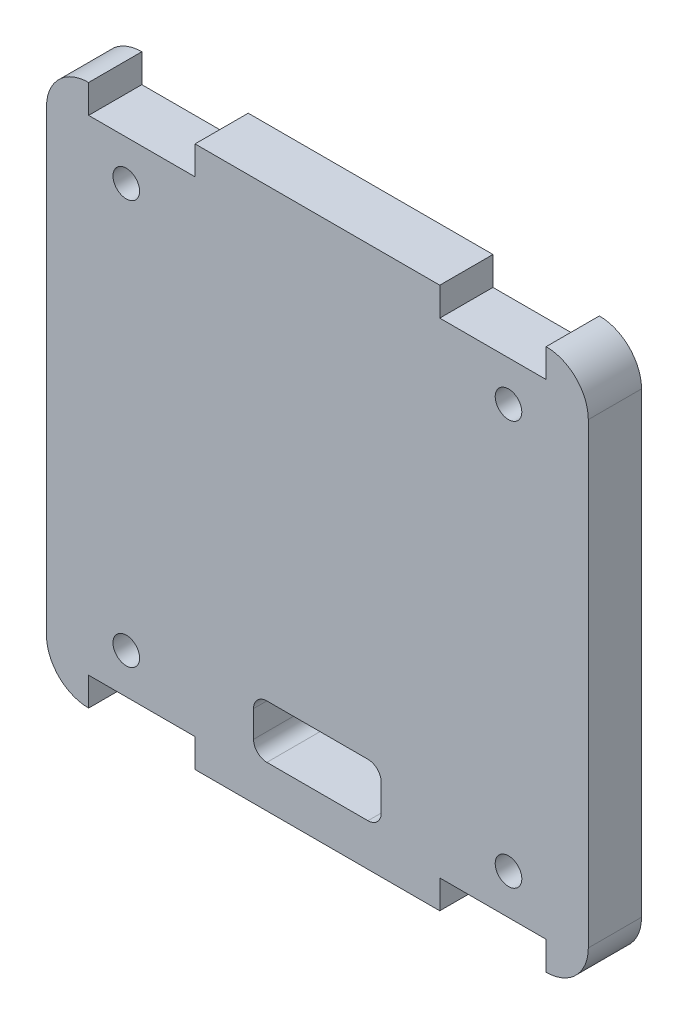
from build123d import *

# Parameters (mm, degrees)
SKETCH1_R           = 1.5875
BOSS_EXTRUDE1_DEPTH = 6.35


with BuildPart() as part:
    # Sketch1 → Boss-Extrude1 (new body)
    with BuildSketch(Plane.XY):
        with BuildLine():
            Line((8672.435520807, 2967.694852803), (8672.435520807, 2913.084852803))
            ThreePointArc((8672.435520807, 2913.084852803), (8670.962502231, 2909.528671379), (8667.406320807, 2908.055652803))
            Line((8667.406320807, 2908.055652803), (8667.406320807, 2911.459252803))
            Line((8667.406320807, 2911.459252803), (8654.706320807, 2911.459252803))
            Line((8654.706320807, 2911.459252803), (8654.706320807, 2908.055652803))
            Line((8654.706320807, 2908.055652803), (8625.496320807, 2908.055652803))
            Line((8625.496320807, 2908.055652803), (8625.496320807, 2911.459252803))
            Line((8625.496320807, 2911.459252803), (8612.796320807, 2911.459252803))
            Line((8612.796320807, 2911.459252803), (8612.796320807, 2908.055652803))
            ThreePointArc((8612.796320807, 2908.055652803), (8609.240139383, 2909.528671379), (8607.767120807, 2913.084852803))
            Line((8607.767120807, 2913.084852803), (8607.767120807, 2967.694852803))
            ThreePointArc((8607.767120807, 2967.694852803), (8609.240139383, 2971.251034227), (8612.796320807, 2972.724052803))
            Line((8612.796320807, 2972.724052803), (8612.796320807, 2969.320452803))
            Line((8612.796320807, 2969.320452803), (8625.496320807, 2969.320452803))
            Line((8625.496320807, 2969.320452803), (8625.496320807, 2972.724052803))
            Line((8625.496320807, 2972.724052803), (8654.706320807, 2972.724052803))
            Line((8654.706320807, 2972.724052803), (8654.706320807, 2969.320452803))
            Line((8654.706320807, 2969.320452803), (8667.406320807, 2969.320452803))
            Line((8667.406320807, 2969.320452803), (8667.406320807, 2972.724052803))
            ThreePointArc((8667.406320807, 2972.724052803), (8670.962502231, 2971.251034227), (8672.435520807, 2967.694852803))
        make_face()
        with Locations((8662.910520807, 2964.519852803)):
            Circle(SKETCH1_R, mode=Mode.SUBTRACT)
        with Locations((8662.910520807, 2916.259852803)):
            Circle(SKETCH1_R, mode=Mode.SUBTRACT)
        with Locations((8617.292120807, 2964.519852803)):
            Circle(SKETCH1_R, mode=Mode.SUBTRACT)
        with Locations((8617.292120807, 2916.259852803)):
            Circle(SKETCH1_R, mode=Mode.SUBTRACT)
        with BuildLine():
            Line((8634.068820807, 2913.084852803), (8646.133820807, 2913.084852803))
            ThreePointArc((8646.133820807, 2913.084852803), (8647.256352822, 2913.549820788), (8647.721320807, 2914.672352803))
            Line((8647.721320807, 2914.672352803), (8647.721320807, 2917.847352803))
            ThreePointArc((8647.721320807, 2917.847352803), (8647.256352822, 2918.969884819), (8646.133820807, 2919.434852803))
            Line((8646.133820807, 2919.434852803), (8634.068820807, 2919.434852803))
            ThreePointArc((8634.068820807, 2919.434852803), (8632.946288792, 2918.969884819), (8632.481320807, 2917.847352803))
            Line((8632.481320807, 2917.847352803), (8632.481320807, 2914.672352803))
            ThreePointArc((8632.481320807, 2914.672352803), (8632.946288792, 2913.549820788), (8634.068820807, 2913.084852803))
        make_face(mode=Mode.SUBTRACT)
    extrude(amount=BOSS_EXTRUDE1_DEPTH)


solid = part.part
